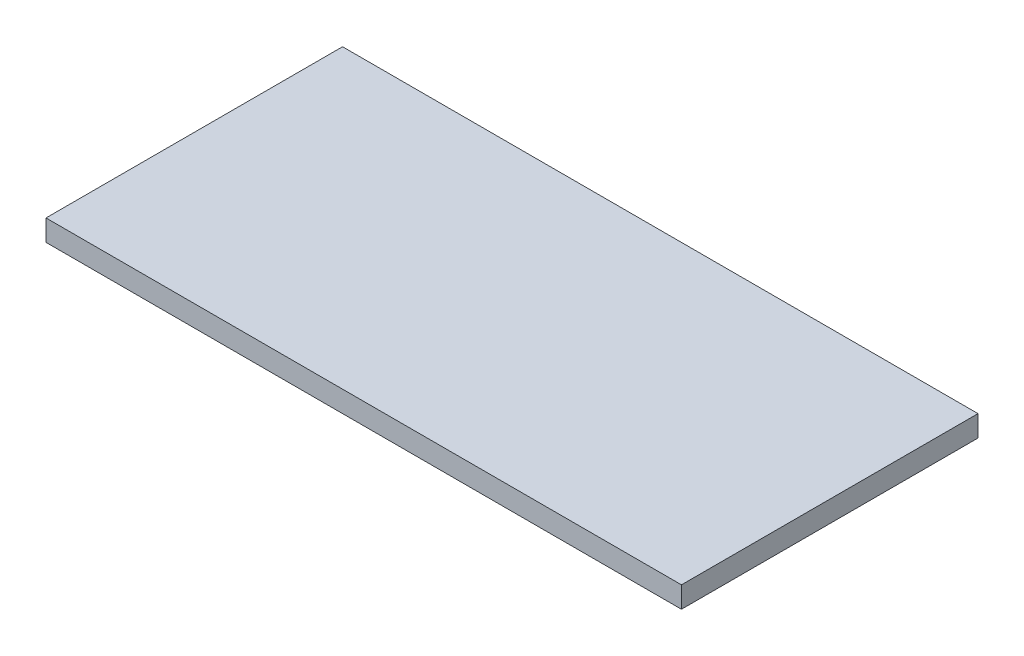
from build123d import *

# Parameters (mm, degrees)
SKETCH1_W           = 150
SKETCH1_H           = 70
BOSS_EXTRUDE1_DEPTH = 5


with BuildPart() as part:
    # Sketch1 → Boss-Extrude1 (new body)
    with BuildSketch(Plane(origin=(0, 0, 0), x_dir=(1, 0, 0), z_dir=(0, 1, 0))):
        with Locations((-2.392120075, -4.962476548)):
            Rectangle(SKETCH1_W, SKETCH1_H)
    extrude(amount=BOSS_EXTRUDE1_DEPTH)


solid = part.part
